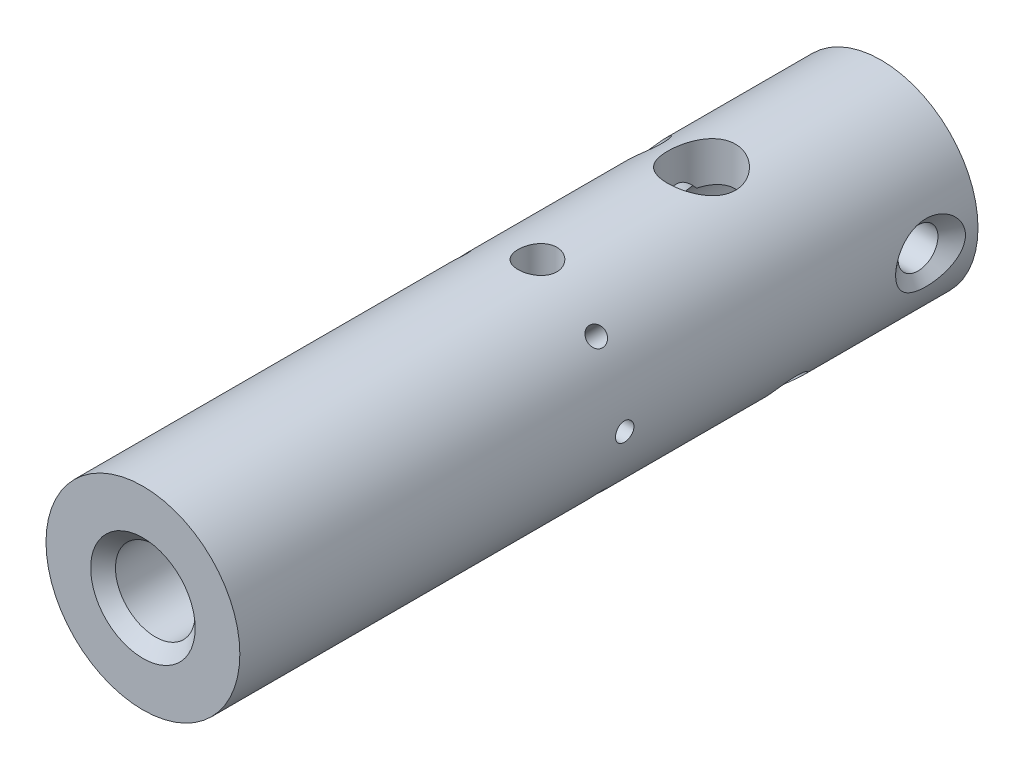
from build123d import *

# Parameters (mm, degrees)
SKETCH1_R                                         = 7.9375
EXTRUDE1_DEPTH                                    = 30.226
F_5_16_18_TAPPED_HOLE1_D                          = 6.5278
F_5_16_18_TAPPED_HOLE1_DEPTH                      = 25.4
F_5_16_18_TAPPED_HOLE1_TIP                        = 1.961148974
CHAMFER1_SIZE                                     = 1.016
F_3_8_0_375_DIAMETER_HOLE1_D                      = 9.525
F_3_8_0_375_DIAMETER_HOLE1_DEPTH                  = 36.83
F_3_8_0_375_DIAMETER_HOLE1_TIP                    = 2.861598698
CSK_FOR_4_FLAT_HEAD_MACHINE_SCREW_100_D           = 3.2639
CSK_FOR_4_FLAT_HEAD_MACHINE_SCREW_100_CSINK_D     = 5.715
CSK_FOR_4_FLAT_HEAD_MACHINE_SCREW_100_CSINK_ANGLE = 100
F_53_0_0595_DIAMETER_HOLE1_D                      = 1.5113
CIRPATTERN1_COUNT                                 = 4
CIRPATTERN1_ANGLE                                 = 135
F_7_32_0_21875_DIAMETER_HOLE1_D                   = 5.55625
F_7_32_0_21875_DIAMETER_HOLE1_DEPTH               = 16.002
F_7_32_0_21875_DIAMETER_HOLE1_TIP                 = 1.669265907
F_1_8_0_125_DIAMETER_HOLE8_D                      = 3.175
F_1_8_0_125_DIAMETER_HOLE9_D                      = 3.175
F_1_8_0_125_DIAMETER_HOLE9_DEPTH                  = 16.002
F_1_8_0_125_DIAMETER_HOLE9_TIP                    = 0.953866233


with BuildPart() as part:
    # Sketch1 → Extrude1 (new, symmetric)
    with BuildSketch(Plane.XY):
        Circle(SKETCH1_R)
    extrude(amount=EXTRUDE1_DEPTH, both=True)

    # 5/16-18 Tapped Hole1
    with Locations(Plane.XY.offset(30.226)):
        with Locations((0, 0)):
            Hole(F_5_16_18_TAPPED_HOLE1_D / 2, depth=F_5_16_18_TAPPED_HOLE1_DEPTH)
            with Locations((0, 0, -(F_5_16_18_TAPPED_HOLE1_DEPTH + F_5_16_18_TAPPED_HOLE1_TIP / 2))):  # 118° drill point
                Cone(0, F_5_16_18_TAPPED_HOLE1_D / 2, F_5_16_18_TAPPED_HOLE1_TIP, mode=Mode.SUBTRACT)

    # Chamfer1
    chamfer1_edges = [part.edges().sort_by_distance(p)[0] for p in [
        (3.2639, 0, 30.226),
    ]]
    chamfer(chamfer1_edges, length=CHAMFER1_SIZE)

    # 3/8 (0.375) Diameter Hole1
    with Locations(Plane(origin=(0, 0, -30.226), x_dir=(-1, 0, 0), z_dir=(0, 0, -1))):
        with Locations((0, 0)):
            Hole(F_3_8_0_375_DIAMETER_HOLE1_D / 2, depth=F_3_8_0_375_DIAMETER_HOLE1_DEPTH)
            with Locations((0, 0, -(F_3_8_0_375_DIAMETER_HOLE1_DEPTH + F_3_8_0_375_DIAMETER_HOLE1_TIP / 2))):  # 118° drill point
                Cone(0, F_3_8_0_375_DIAMETER_HOLE1_D / 2, F_3_8_0_375_DIAMETER_HOLE1_TIP, mode=Mode.SUBTRACT)

    # CSK for #4 Flat Head Machine Screw (100)1 (through all)
    with Locations(Plane(origin=(7.9375, 0, 0), x_dir=(0, 0, -1), z_dir=(1, 0, 0))):
        with Locations((26.3398, 0)):
            CounterSinkHole(CSK_FOR_4_FLAT_HEAD_MACHINE_SCREW_100_D / 2, CSK_FOR_4_FLAT_HEAD_MACHINE_SCREW_100_CSINK_D / 2, counter_sink_angle=CSK_FOR_4_FLAT_HEAD_MACHINE_SCREW_100_CSINK_ANGLE)

    # #53 (0.0595) Diameter Hole1 (through all)
    with Locations(Plane(origin=(7.9375, 0, 0), x_dir=(0, 0, -1), z_dir=(1, 0, 0))):
        with Locations((1.2954, 0)):
            f_53_0_0595_diameter_hole1 = Hole(F_53_0_0595_DIAMETER_HOLE1_D / 2)

    # CirPattern1: #53 (0.0595) Diameter Hole1 ×4 about axis
    cirpattern1_axis = Axis((0, 0, 30.226), (0, 0, -1))
    for i in range(1, CIRPATTERN1_COUNT):
        add(f_53_0_0595_diameter_hole1.rotate(cirpattern1_axis, i * CIRPATTERN1_ANGLE / (CIRPATTERN1_COUNT - 1)), mode=Mode.SUBTRACT)

    # 7/32 (0.21875) Diameter Hole1
    with Locations(Plane(origin=(0, 7.9375, -30.226), x_dir=(-1, 0, 0), z_dir=(0, 1, 0))):
        with Locations((0, 14.7066)):
            Hole(F_7_32_0_21875_DIAMETER_HOLE1_D / 2, depth=F_7_32_0_21875_DIAMETER_HOLE1_DEPTH)
            with Locations((0, 0, -(F_7_32_0_21875_DIAMETER_HOLE1_DEPTH + F_7_32_0_21875_DIAMETER_HOLE1_TIP / 2))):  # 118° drill point
                Cone(0, F_7_32_0_21875_DIAMETER_HOLE1_D / 2, F_7_32_0_21875_DIAMETER_HOLE1_TIP, mode=Mode.SUBTRACT)

    # 1/8 (0.125) Diameter Hole8 (through all)
    with Locations(Plane(origin=(-5.612660076, 5.612660076, -30.226), x_dir=(-0.7071067811865489, -0.7071067811865461, 0), z_dir=(-0.7071067811865461, 0.7071067811865489, 0))):
        with Locations((0, 13.5382)):
            Hole(F_1_8_0_125_DIAMETER_HOLE8_D / 2)

    # 1/8 (0.125) Diameter Hole9
    with Locations(Plane(origin=(0, 7.9375, -30.226), x_dir=(-1, 0, 0), z_dir=(0, 1, 0))):
        with Locations((0, 28.1432)):
            Hole(F_1_8_0_125_DIAMETER_HOLE9_D / 2, depth=F_1_8_0_125_DIAMETER_HOLE9_DEPTH)
            with Locations((0, 0, -(F_1_8_0_125_DIAMETER_HOLE9_DEPTH + F_1_8_0_125_DIAMETER_HOLE9_TIP / 2))):  # 118° drill point
                Cone(0, F_1_8_0_125_DIAMETER_HOLE9_D / 2, F_1_8_0_125_DIAMETER_HOLE9_TIP, mode=Mode.SUBTRACT)


solid = part.part
